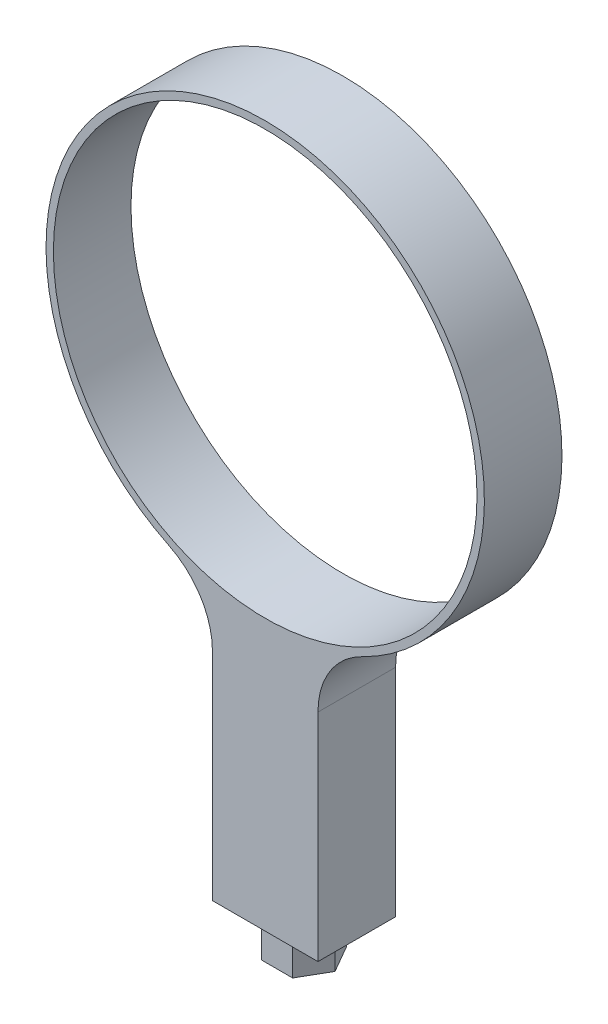
from build123d import *

# Parameters (mm, degrees)
SKETCH1_R           = 54.6
BOSS_EXTRUDE1_DEPTH = 20
BOSS_EXTRUDE2_DEPTH = 10


with BuildPart() as part:
    # Sketch1 → Boss-Extrude1 (new body)
    with BuildSketch(Plane.XY):
        with BuildLine():
            ThreePointArc((24.815698382, -50.75855705), (16.634074625, -58.135776168), (13.600016394, -68.726187864))
            Line((13.600016394, -68.726187864), (13.600016394, -124.425859017))
            Line((13.600016394, -124.425859017), (-13.600016394, -124.425859017))
            Line((-13.600016394, -124.425859017), (-13.600016394, -68.726187864))
            ThreePointArc((-13.600016394, -68.726187864), (-16.634074625, -58.135776168), (-24.815698382, -50.75855705))
            ThreePointArc((-24.815698382, -50.75855705), (0, 56.5), (24.815698382, -50.75855705))
        make_face()
        Circle(SKETCH1_R, mode=Mode.SUBTRACT)
    extrude(amount=BOSS_EXTRUDE1_DEPTH)

    # Sketch3 → Boss-Extrude2 (add)
    with BuildSketch(Plane(origin=(0, -124.425859017, 0), x_dir=(-1, 0, 0), z_dir=(0, -1, 0))):
        Polygon((4, -16.92820323), (5.615919889, -14.129347882), (0, -10), (-5.615919889, -14.129347882), (-4, -16.92820323), align=None)
        Polygon((-5.615919889, -14.129347882), (0, -10), (-5.615919889, -5.870652118), (-8, -10), align=None)
        Polygon((-5.615919889, -5.870652118), (0, -10), (5.615919889, -5.870652118), (4, -3.07179677), (-4, -3.07179677), align=None)
        Polygon((0, -10), (5.615919889, -14.129347882), (8, -10), (5.615919889, -5.870652118), align=None)
    extrude(amount=BOSS_EXTRUDE2_DEPTH)


solid = part.part
